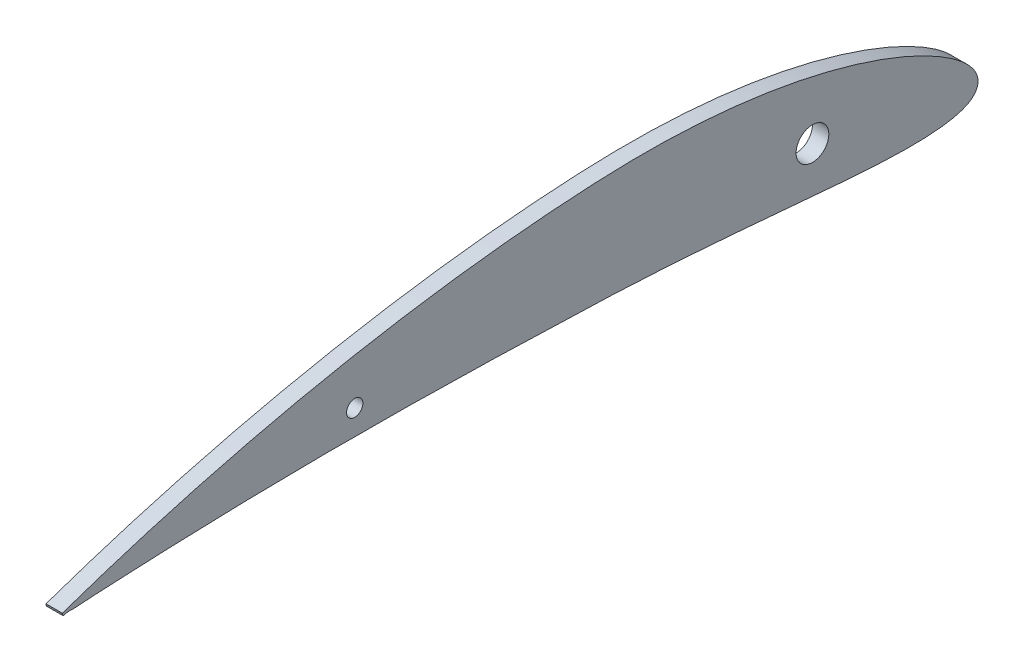
from build123d import *

# Parameters (mm, degrees)
BOSS_EXTRUDE1_DEPTH      = 3.175
BOSS_EXTRUDE1_DEPTH_BACK = 3.175
CUT_EXTRUDE1_DEPTH       = 358.425151942
CUT_EXTRUDE1_DEPTH_BACK  = 358.425151942
SKETCH2_R                = 6.35
SKETCH2_R_2              = 3.175


with BuildPart() as part:
    # Sketch1 → Boss-Extrude1 (new, two sides: drawn at the far end of the back side and taken through both)
    with BuildSketch(Plane(origin=(0, 0, 0), x_dir=(0, 0, -1), z_dir=(1, 0, 0)).offset(-BOSS_EXTRUDE1_DEPTH_BACK)):
        with BuildLine():
            Line((-354.787327228, -0.030257196), (-354.876173011, 0.410417887))
            add(Edge.make_bspline(
                [(-354.876173011, 0.410417887), (-354.559877309, 0.519388), (-353.29965963, 0.95355787), (-350.47872665, 1.927095868), (-345.800950265, 3.497798274), (-336.024074692, 6.721551148), (-319.654473712, 11.798891927), (-300.598349456, 17.130600639), (-282.422876264, 21.724272526), (-261.175777938, 26.651569731), (-238.622276389, 31.145528798), (-208.774809213, 36.004755717), (-183.96165787, 39.090454058), (-158.902335219, 41.113212891), (-140.096691022, 42.111376668), (-121.516747473, 42.228858195), (-103.422167262, 41.321050632), (-86.188408528, 39.478676181), (-70.043450957, 36.810480574), (-55.199760436, 33.432905997), (-41.843390777, 29.510854383), (-30.130463623, 25.220125297), (-20.187014188, 20.73431935), (-12.107203154, 16.226289935), (-5.926897661, 11.855341958), (-1.679224073, 7.716499794), (0.765838065, 3.796757813), (0.987487677, -0.148325216), (-1.35108726, -3.308943186), (-5.450780885, -5.288085739), (-11.087315968, -6.587464624), (-18.34911979, -7.268527656), (-27.163826626, -7.404874951), (-37.447057223, -7.053797092), (-49.083078017, -6.301866785), (-61.95239395, -5.238034817), (-75.929862643, -3.983911698), (-96.406736552, -2.153555858), (-117.937239158, -0.458414508), (-140.484776897, 0.674535203), (-158.296467959, 1.286744043), (-176.48388462, 1.917893193), (-200.671973719, 2.586246563), (-224.541124114, 2.979106232), (-247.830237405, 3.028480659), (-264.337268621, 2.907447598), (-279.933149694, 2.656365926), (-294.437996632, 2.282890374), (-307.681856469, 1.852126627), (-319.513378006, 1.371074809), (-329.767358246, 0.912902227), (-338.388880463, 0.426846955), (-345.076973543, 0.191518705), (-350.227621538, -0.406394891), (-352.780150329, -0.035387827), (-354.744619464, -0.75811662), (-354.777220059, -0.20251155), (-354.787327228, -0.030257196)],
                knots=[0, 0, 0, 0, 0.001371577, 0.005464776, 0.012234802, 0.021601969, 0.04767125, 0.082496261, 0.102719149, 0.124527079, 0.171912573, 0.19697838, 0.248496767, 0.274385101, 0.300041178, 0.325689988, 0.350525088, 0.374279703, 0.396711254, 0.417576734, 0.436654006, 0.45374439, 0.468679994, 0.481329415, 0.491630702, 0.499615789, 0.505546281, 0.510184984, 0.514824194, 0.520701508, 0.52851604, 0.538465752, 0.550542609, 0.564643256, 0.580638139, 0.598344876, 0.617584458, 0.638174401, 0.682632113, 0.706120665, 0.730727383, 0.755700244, 0.780731769, 0.829932396, 0.853570292, 0.876213105, 0.897609987, 0.917519394, 0.935698347, 0.951942678, 0.966047159, 0.97783994, 0.987174002, 0.993931501, 0.998018399, 0.999385644, 1, 1, 1, 1], degree=3))
        make_face()
    extrude(amount=BOSS_EXTRUDE1_DEPTH + BOSS_EXTRUDE1_DEPTH_BACK)

    # Sketch2 → Cut-Extrude1 (cut, two sides: drawn at the far end of the back side and taken through both)
    with BuildSketch(Plane.ZY.offset(3.175).offset(-CUT_EXTRUDE1_DEPTH_BACK)):
        with Locations((63.5, 12.7)):
            Circle(SKETCH2_R)
        with Locations((241.3, 12.7)):
            Circle(SKETCH2_R_2)
    extrude(amount=CUT_EXTRUDE1_DEPTH + CUT_EXTRUDE1_DEPTH_BACK, mode=Mode.SUBTRACT)


solid = part.part
